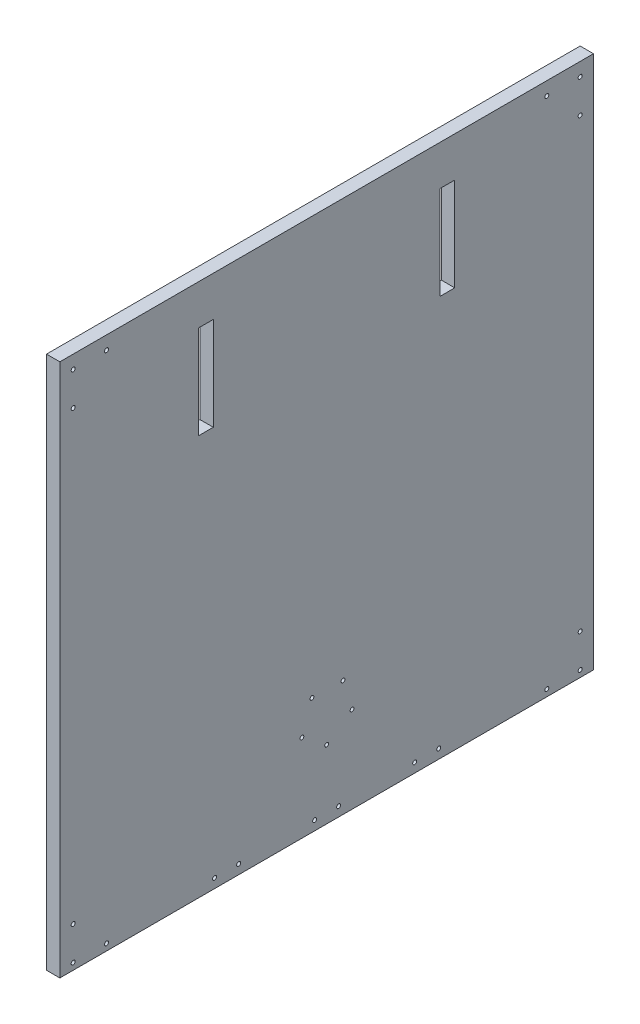
from build123d import *

# Parameters (mm, degrees)
SKETCH_1_W          = 400
SKETCH_1_H          = 400
EXTRUDE_1_DEPTH     = 10
SKETCH_2_R          = 1.5
CUT_EXTRUDE_1_DEPTH = 10
SKETCH_3_R          = 1.5
CUT_EXTRUDE_2_DEPTH = 10
SKETCH_4_R          = 1.45
CUT_EXTRUDE_3_DEPTH = 10
SKETCH_5_W          = 11
SKETCH_5_H          = 70
CUT_EXTRUDE_5_DEPTH = 10


with BuildPart() as part:
    # 草图1 → 凸台-拉伸1 (new body)
    with BuildSketch(Plane(origin=(0, 0, 0), x_dir=(0, 0, -1), z_dir=(1, 0, 0))):
        Rectangle(SKETCH_1_W, SKETCH_1_H)
    extrude(amount=EXTRUDE_1_DEPTH)

    # 草图2 → 切除-拉伸1 (cut)
    with BuildSketch(Plane(origin=(10, 0, 0), x_dir=(0, 0, -1), z_dir=(1, 0, 0))):
        with Locations((190, 190)):
            Circle(SKETCH_2_R)
        with Locations((165, 190)):
            Circle(SKETCH_2_R)
        with Locations((190, 165)):
            Circle(SKETCH_2_R)
        with Locations((190, -195)):
            Circle(SKETCH_2_R)
        with Locations((165, -195)):
            Circle(SKETCH_2_R)
        with Locations((190, -170)):
            Circle(SKETCH_2_R)
    cut_extrude_1 = extrude(amount=-CUT_EXTRUDE_1_DEPTH, mode=Mode.SUBTRACT)

    # 草图3 → 切除-拉伸2 (cut)
    with BuildSketch(Plane(origin=(10, 0, 0), x_dir=(0, 0, -1), z_dir=(1, 0, 0))):
        with Locations((-84, -193)):
            Circle(SKETCH_3_R)
        with Locations((-66, -193)):
            Circle(SKETCH_3_R)
        with Locations((-9, -193)):
            Circle(SKETCH_3_R)
        with Locations((9, -193)):
            Circle(SKETCH_3_R)
        with Locations((66, -193)):
            Circle(SKETCH_3_R)
        with Locations((84, -193)):
            Circle(SKETCH_3_R)
    extrude(amount=-CUT_EXTRUDE_2_DEPTH, mode=Mode.SUBTRACT)

    # 镜向1: 切除-拉伸1 across plane
    add(cut_extrude_1.mirror(Plane.XY), mode=Mode.SUBTRACT)

    # 草图4 → 切除-拉伸3 (cut)
    with BuildSketch(Plane(origin=(10, 0, 0), x_dir=(0, 0, -1), z_dir=(1, 0, 0))):
        with Locations((-11.007896697, -112.622517601)):
            Circle(SKETCH_4_R)
        with Locations((12.238028253, -113.022211572)):
            Circle(SKETCH_4_R)
        with Locations((-18.571414113, -134.607193773)):
            Circle(SKETCH_4_R)
        with Locations((19.041282557, -135.253912204)):
            Circle(SKETCH_4_R)
        with Locations((0, -148.59416485)):
            Circle(SKETCH_4_R)
    extrude(amount=-CUT_EXTRUDE_3_DEPTH, mode=Mode.SUBTRACT)

    # 草图5 → 切除-拉伸5 (cut)
    with BuildSketch(Plane(origin=(0, 0, 0), x_dir=(0, 0, -1), z_dir=(1, 0, 0))):
        with Locations((-90.5, 135)):
            Rectangle(SKETCH_5_W, SKETCH_5_H)
        with Locations((90.5, 135)):
            Rectangle(SKETCH_5_W, SKETCH_5_H)
    extrude(amount=CUT_EXTRUDE_5_DEPTH, mode=Mode.SUBTRACT)


solid = part.part
